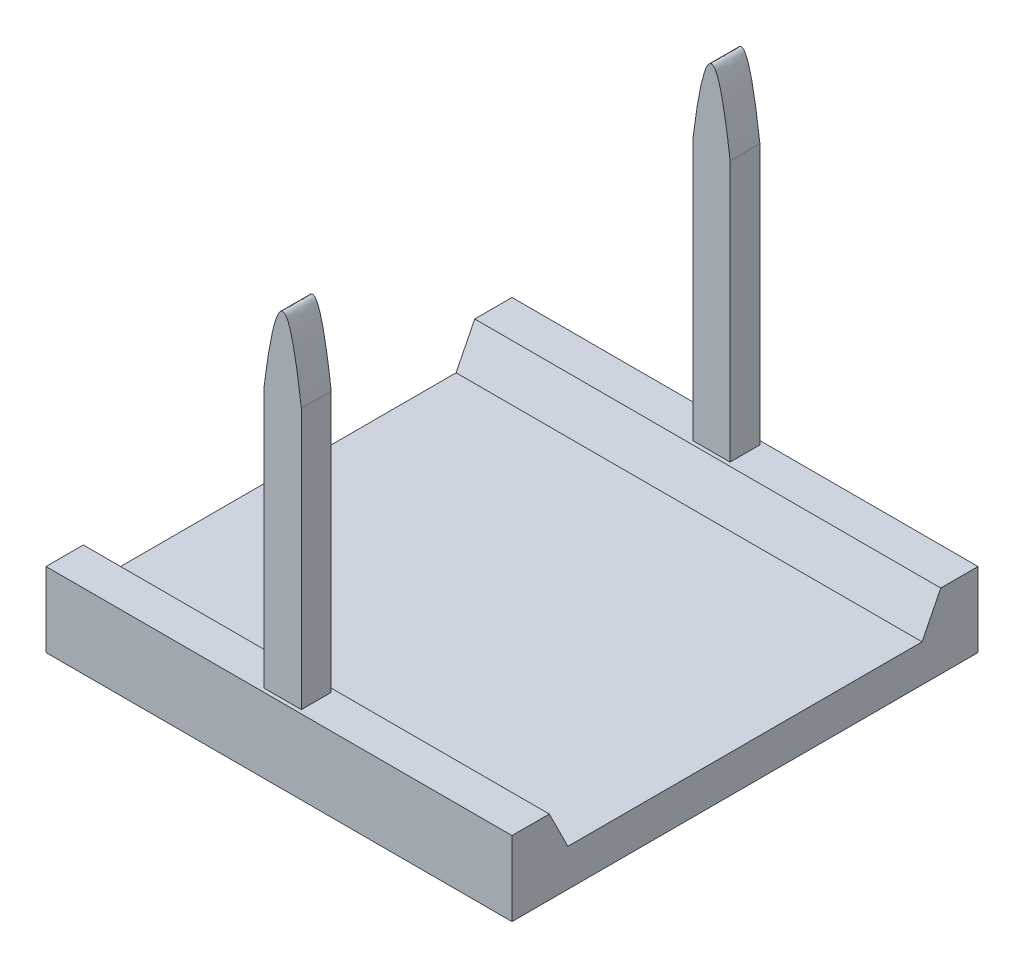
from build123d import *

# Parameters (mm, degrees)
SKETCH2_W               = 125
SKETCH2_H               = 125
BOSS_EXTRUDE1_DEPTH     = 20
CUT_EXTRUDE1_DEPTH      = 178.904468747
CUT_EXTRUDE1_DEPTH_BACK = 178.904468747
BOSS_EXTRUDE2_DEPTH     = 10
CUT_EXTRUDE2_DEPTH      = 1
CUT_EXTRUDE3_DEPTH      = 1


with BuildPart() as part:
    # Sketch2 → Boss-Extrude1 (new body)
    with BuildSketch(Plane(origin=(0, 0, 0), x_dir=(1, 0, 0), z_dir=(0, 1, 0))):
        with Locations((62.5, 62.5)):
            Rectangle(SKETCH2_W, SKETCH2_H)
    extrude(amount=BOSS_EXTRUDE1_DEPTH)

    # Sketch4 → Cut-Extrude1 (cut, two sides: drawn at the far end of the back side and taken through both)
    with BuildSketch(Plane(origin=(125, 0, 0), x_dir=(0, 0, -1), z_dir=(1, 0, 0)).offset(-CUT_EXTRUDE1_DEPTH_BACK)):
        Polygon((-98.875201044, 237.750402088), (10, 20), (15, 10), (110, 10), (115, 20), (223.875201044, 237.750402088), (223.875201044, 724.655103285), (-98.875201044, 724.655103285), align=None)
    extrude(amount=CUT_EXTRUDE1_DEPTH + CUT_EXTRUDE1_DEPTH_BACK, mode=Mode.SUBTRACT)

    # Sketch3 → Boss-Extrude2 (add)
    with BuildSketch(Plane.XY):
        with BuildLine():
            Line((57.5, 20), (57.5, 90))
            add(Edge.make_bspline(
                [(57.5, 90), (62.5, 130), (67.5, 90)],
                knots=[0, 0, 0, 1, 1, 1], degree=2))
            Line((67.5, 90), (67.5, 20))
            Line((67.5, 20), (57.5, 20))
        make_face()
    boss_extrude2 = extrude(amount=-BOSS_EXTRUDE2_DEPTH)

    # Sketch6 → Cut-Extrude2 (cut)
    with BuildSketch(Plane.XY):
        with BuildLine():
            Line((57.5, 20), (67.5, 20))
            Line((67.5, 20), (67.5, 90))
            add(Edge.make_bspline(
                [(67.5, 90), (62.500000001, 129.999999993), (57.500000002, 90.000000015)],
                knots=[0, 0, 0, 1, 1, 1], degree=2))
            Line((57.500000002, 90.000000015), (57.5, 20))
        make_face()
    cut_extrude2 = extrude(amount=-CUT_EXTRUDE2_DEPTH, mode=Mode.SUBTRACT)

    # Sketch7 → Cut-Extrude3 (cut)
    with BuildSketch(Plane(origin=(0, 0, -10), x_dir=(-1, 0, 0), z_dir=(0, 0, -1))):
        with BuildLine():
            Line((-67.5, 20), (-57.5, 20))
            Line((-57.5, 20), (-57.5, 90))
            add(Edge.make_bspline(
                [(-57.5, 90), (-62.499999999, 129.999999993), (-67.499999998, 90.000000015)],
                knots=[0, 0, 0, 1, 1, 1], degree=2))
            Line((-67.499999998, 90.000000015), (-67.5, 20))
        make_face()
    cut_extrude3 = extrude(amount=-CUT_EXTRUDE3_DEPTH, mode=Mode.SUBTRACT)

    # Mirror1: Boss-Extrude2, Cut-Extrude2, Cut-Extrude3 across plane
    add(boss_extrude2.mirror(Plane.XY.offset(-62.5)))
    add(cut_extrude2.mirror(Plane.XY.offset(-62.5)), mode=Mode.SUBTRACT)
    add(cut_extrude3.mirror(Plane.XY.offset(-62.5)), mode=Mode.SUBTRACT)


solid = part.part
